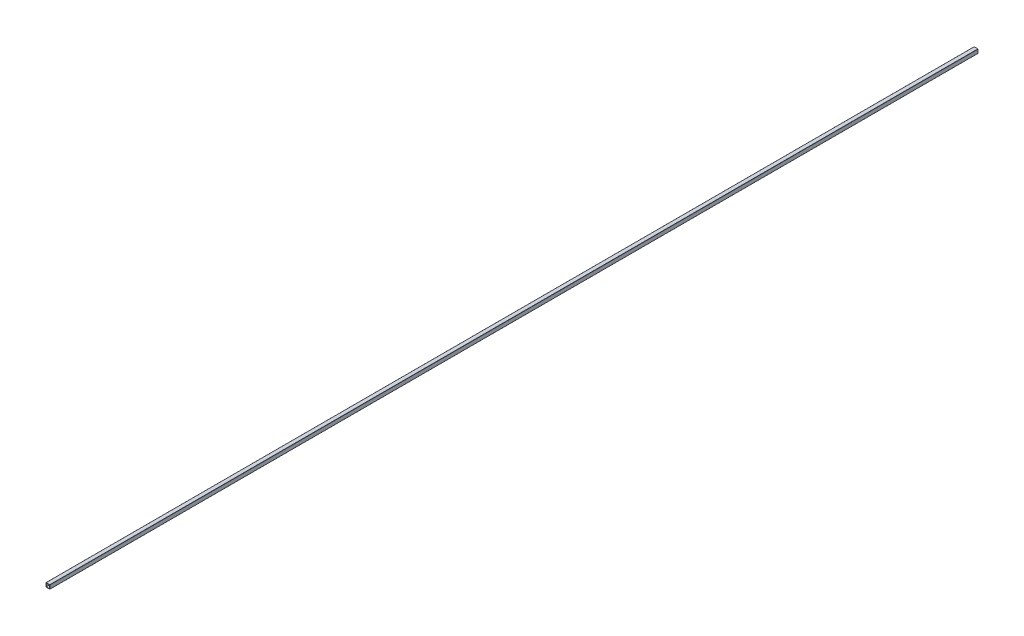
from build123d import *

# Parameters (mm, degrees)
CROQUIS1_W              = 21.62
CROQUIS1_H              = 21.62
SALIENTE_EXTRUIR1_DEPTH = 6000


with BuildPart() as part:
    # Croquis1 → Saliente-Extruir1 (new body)
    with BuildSketch(Plane.XY):
        with BuildLine():
            Line((-11.7, -12.7), (11.7, -12.7))
            ThreePointArc((11.7, -12.7), (12.407106781, -12.407106781), (12.7, -11.7))
            Line((12.7, -11.7), (12.7, 11.7))
            ThreePointArc((12.7, 11.7), (12.407106781, 12.407106781), (11.7, 12.7))
            Line((11.7, 12.7), (-11.7, 12.7))
            ThreePointArc((-11.7, 12.7), (-12.407106781, 12.407106781), (-12.7, 11.7))
            Line((-12.7, 11.7), (-12.7, -11.7))
            ThreePointArc((-12.7, -11.7), (-12.407106781, -12.407106781), (-11.7, -12.7))
        make_face()
        Rectangle(CROQUIS1_W, CROQUIS1_H, mode=Mode.SUBTRACT)
    extrude(amount=SALIENTE_EXTRUIR1_DEPTH)


solid = part.part
